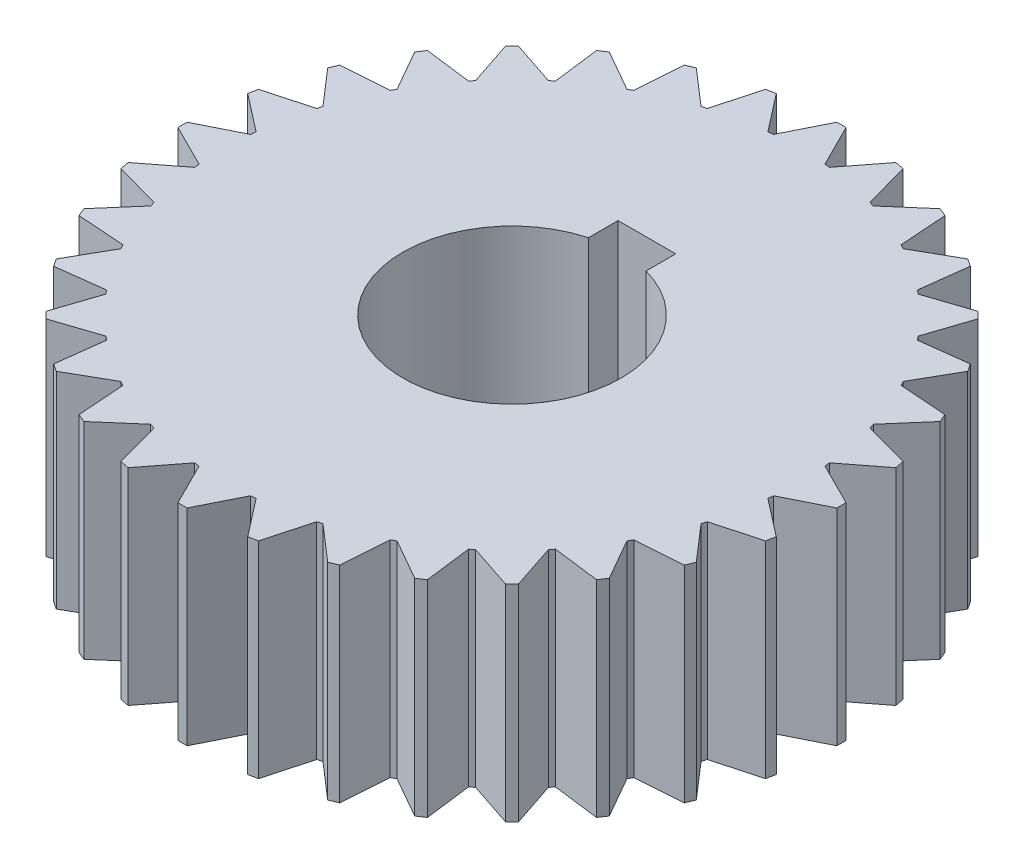
from build123d import *

# Parameters (mm, degrees)
BOSS_EXTRUDE1_DEPTH = 12.7
SKETCH2_OUTSIDE_W   = 55.852
SKETCH2_OUTSIDE_H   = 55.852
SKETCH2_OUTSIDE_R   = 20.32
CUT_EXTRUDE1_DEPTH  = 33.149212754
CUT_EXTRUDE3_DEPTH  = 32.418064867


with BuildPart() as part:
    # Sketch1 → Boss-Extrude1 (new body)
    with BuildSketch(Plane(origin=(0, 0, 0), x_dir=(1, 0, 0), z_dir=(0, 1, 0))):
        with BuildLine():
            Line((0, 20.883987655), (-1.5875, 17.708987655))
            ThreePointArc((-1.5875, 17.708987655), (-1.742744755, 17.69438444), (-1.897855471, 17.678420309))
            Line((-1.897855471, 17.678420309), (-4.074263877, 20.482707688))
            Line((-4.074263877, 20.482707688), (-5.011848737, 17.059008536))
            ThreePointArc((-5.011848737, 17.059008536), (-5.161261562, 17.014399169), (-5.310277422, 16.968481184))
            Line((-5.310277422, 16.968481184), (-7.991956077, 19.294288751))
            Line((-7.991956077, 19.294288751), (-8.243594937, 15.753461287))
            ThreePointArc((-8.243594937, 15.753461287), (-8.381433981, 15.68056008), (-8.518628388, 15.606452844))
            Line((-8.518628388, 15.606452844), (-11.602521888, 17.364401118))
            Line((-11.602521888, 17.364401118), (-11.158544407, 13.842517355))
            ThreePointArc((-11.158544407, 13.842517355), (-11.279512592, 13.744125861), (-11.399613243, 13.644677274))
            Line((-11.399613243, 13.644677274), (-14.767209289, 14.767209289))
            Line((-14.767209289, 14.767209289), (-13.644677274, 11.399613243))
            ThreePointArc((-13.644677274, 11.399613243), (-13.744125861, 11.279512592), (-13.842517355, 11.158544407))
            Line((-13.842517355, 11.158544407), (-17.364401118, 11.602521888))
            Line((-17.364401118, 11.602521888), (-15.606452844, 8.518628388))
            ThreePointArc((-15.606452844, 8.518628388), (-15.68056008, 8.381433981), (-15.753461287, 8.243594937))
            Line((-15.753461287, 8.243594937), (-19.294288751, 7.991956077))
            Line((-19.294288751, 7.991956077), (-16.968481184, 5.310277422))
            ThreePointArc((-16.968481184, 5.310277422), (-17.014399169, 5.161261562), (-17.059008536, 5.011848737))
            Line((-17.059008536, 5.011848737), (-20.482707688, 4.074263877))
            Line((-20.482707688, 4.074263877), (-17.678420309, 1.897855471))
            ThreePointArc((-17.678420309, 1.897855471), (-17.69438444, 1.742744755), (-17.708987655, 1.5875))
            Line((-17.708987655, 1.5875), (-20.883987655, 0))
            Line((-20.883987655, 0), (-17.708987655, -1.5875))
            ThreePointArc((-17.708987655, -1.5875), (-17.69438444, -1.742744755), (-17.678420309, -1.897855471))
            Line((-17.678420309, -1.897855471), (-20.482707688, -4.074263877))
            Line((-20.482707688, -4.074263877), (-17.059008536, -5.011848737))
            ThreePointArc((-17.059008536, -5.011848737), (-17.014399169, -5.161261562), (-16.968481184, -5.310277422))
            Line((-16.968481184, -5.310277422), (-19.294288751, -7.991956077))
            Line((-19.294288751, -7.991956077), (-15.753461287, -8.243594937))
            ThreePointArc((-15.753461287, -8.243594937), (-15.68056008, -8.381433981), (-15.606452844, -8.518628388))
            Line((-15.606452844, -8.518628388), (-17.364401118, -11.602521888))
            Line((-17.364401118, -11.602521888), (-13.842517355, -11.158544407))
            ThreePointArc((-13.842517355, -11.158544407), (-13.744125861, -11.279512592), (-13.644677274, -11.399613243))
            Line((-13.644677274, -11.399613243), (-14.767209289, -14.767209289))
            Line((-14.767209289, -14.767209289), (-11.399613243, -13.644677274))
            ThreePointArc((-11.399613243, -13.644677274), (-11.279512592, -13.744125861), (-11.158544407, -13.842517355))
            Line((-11.158544407, -13.842517355), (-11.602521888, -17.364401118))
            Line((-11.602521888, -17.364401118), (-8.518628388, -15.606452844))
            ThreePointArc((-8.518628388, -15.606452844), (-8.381433981, -15.68056008), (-8.243594937, -15.753461287))
            Line((-8.243594937, -15.753461287), (-7.991956077, -19.294288751))
            Line((-7.991956077, -19.294288751), (-5.310277422, -16.968481184))
            ThreePointArc((-5.310277422, -16.968481184), (-5.161261562, -17.014399169), (-5.011848737, -17.059008536))
            Line((-5.011848737, -17.059008536), (-4.074263877, -20.482707688))
            Line((-4.074263877, -20.482707688), (-1.897855471, -17.678420309))
            ThreePointArc((-1.897855471, -17.678420309), (-1.742744755, -17.69438444), (-1.5875, -17.708987655))
            Line((-1.5875, -17.708987655), (0, -20.883987655))
            Line((0, -20.883987655), (1.5875, -17.708987655))
            ThreePointArc((1.5875, -17.708987655), (1.742744755, -17.69438444), (1.897855471, -17.678420309))
            Line((1.897855471, -17.678420309), (4.074263877, -20.482707688))
            Line((4.074263877, -20.482707688), (5.011848737, -17.059008536))
            ThreePointArc((5.011848737, -17.059008536), (5.161261562, -17.014399169), (5.310277422, -16.968481184))
            Line((5.310277422, -16.968481184), (7.991956077, -19.294288751))
            Line((7.991956077, -19.294288751), (8.243594937, -15.753461287))
            ThreePointArc((8.243594937, -15.753461287), (8.381433981, -15.68056008), (8.518628388, -15.606452844))
            Line((8.518628388, -15.606452844), (11.602521888, -17.364401118))
            Line((11.602521888, -17.364401118), (11.158544407, -13.842517355))
            ThreePointArc((11.158544407, -13.842517355), (11.279512592, -13.744125861), (11.399613243, -13.644677274))
            Line((11.399613243, -13.644677274), (14.767209289, -14.767209289))
            Line((14.767209289, -14.767209289), (13.644677274, -11.399613243))
            ThreePointArc((13.644677274, -11.399613243), (13.744125861, -11.279512592), (13.842517355, -11.158544407))
            Line((13.842517355, -11.158544407), (17.364401118, -11.602521888))
            Line((17.364401118, -11.602521888), (15.606452844, -8.518628388))
            ThreePointArc((15.606452844, -8.518628388), (15.68056008, -8.381433981), (15.753461287, -8.243594937))
            Line((15.753461287, -8.243594937), (19.294288751, -7.991956077))
            Line((19.294288751, -7.991956077), (16.968481184, -5.310277422))
            ThreePointArc((16.968481184, -5.310277422), (17.014399169, -5.161261562), (17.059008536, -5.011848737))
            Line((17.059008536, -5.011848737), (20.482707688, -4.074263877))
            Line((20.482707688, -4.074263877), (17.678420309, -1.897855471))
            ThreePointArc((17.678420309, -1.897855471), (17.69438444, -1.742744755), (17.708987655, -1.5875))
            Line((17.708987655, -1.5875), (20.883987655, 0))
            Line((20.883987655, 0), (17.708987655, 1.5875))
            ThreePointArc((17.708987655, 1.5875), (17.69438444, 1.742744755), (17.678420309, 1.897855471))
            Line((17.678420309, 1.897855471), (20.482707688, 4.074263877))
            Line((20.482707688, 4.074263877), (17.059008536, 5.011848737))
            ThreePointArc((17.059008536, 5.011848737), (17.014399169, 5.161261562), (16.968481184, 5.310277422))
            Line((16.968481184, 5.310277422), (19.294288751, 7.991956077))
            Line((19.294288751, 7.991956077), (15.753461287, 8.243594937))
            ThreePointArc((15.753461287, 8.243594937), (15.68056008, 8.381433981), (15.606452844, 8.518628388))
            Line((15.606452844, 8.518628388), (17.364401118, 11.602521888))
            Line((17.364401118, 11.602521888), (13.842517355, 11.158544407))
            ThreePointArc((13.842517355, 11.158544407), (13.744125861, 11.279512592), (13.644677274, 11.399613243))
            Line((13.644677274, 11.399613243), (14.767209289, 14.767209289))
            Line((14.767209289, 14.767209289), (11.399613243, 13.644677274))
            ThreePointArc((11.399613243, 13.644677274), (11.279512592, 13.744125861), (11.158544407, 13.842517355))
            Line((11.158544407, 13.842517355), (11.602521888, 17.364401118))
            Line((11.602521888, 17.364401118), (8.518628388, 15.606452844))
            ThreePointArc((8.518628388, 15.606452844), (8.381433981, 15.68056008), (8.243594937, 15.753461287))
            Line((8.243594937, 15.753461287), (7.991956077, 19.294288751))
            Line((7.991956077, 19.294288751), (5.310277422, 16.968481184))
            ThreePointArc((5.310277422, 16.968481184), (5.161261562, 17.014399169), (5.011848737, 17.059008536))
            Line((5.011848737, 17.059008536), (4.074263877, 20.482707688))
            Line((4.074263877, 20.482707688), (1.897855471, 17.678420309))
            ThreePointArc((1.897855471, 17.678420309), (1.742744755, 17.69438444), (1.5875, 17.708987655))
            Line((1.5875, 17.708987655), (0, 20.883987655))
        make_face()
    extrude(amount=BOSS_EXTRUDE1_DEPTH)

    # Sketch2 outside → Cut-Extrude1 (cut, through all)
    with BuildSketch(Plane(origin=(0, 12.7, 0), x_dir=(1, 0, 0), z_dir=(0, 1, 0))):
        Rectangle(SKETCH2_OUTSIDE_W, SKETCH2_OUTSIDE_H)
        Circle(SKETCH2_OUTSIDE_R, mode=Mode.SUBTRACT)
    extrude(amount=-CUT_EXTRUDE1_DEPTH, mode=Mode.SUBTRACT)

    # Sketch3 → Cut-Extrude3 (cut, through all)
    with BuildSketch(Plane(origin=(0, 12.7, 0), x_dir=(1, 0, 0), z_dir=(0, 1, 0))):
        with BuildLine():
            ThreePointArc((1.778, 6.491923983), (0, 6.731), (-1.778, 6.491923983))
            Line((-1.778, 6.491923983), (-1.778, 5.1435))
            Line((-1.778, 5.1435), (1.778, 5.1435))
            Line((1.778, 5.1435), (1.778, 6.491923983))
        make_face()
        with BuildLine():
            Line((-1.778, 5.1435), (-1.778, 6.491923983))
            ThreePointArc((-1.778, 6.491923983), (-4.082808041, -5.351358659), (6.731, 0))
            ThreePointArc((6.731, 0), (5.351358659, 4.082808041), (1.778, 6.491923983))
            Line((1.778, 6.491923983), (1.778, 5.1435))
            Line((1.778, 5.1435), (-1.778, 5.1435))
        make_face()
        with BuildLine():
            Line((1.778, 8.3185), (-1.778, 8.3185))
            Line((-1.778, 8.3185), (-1.778, 6.491923983))
            ThreePointArc((-1.778, 6.491923983), (0, 6.731), (1.778, 6.491923983))
            Line((1.778, 6.491923983), (1.778, 8.3185))
        make_face()
    extrude(amount=-CUT_EXTRUDE3_DEPTH, mode=Mode.SUBTRACT)


solid = part.part
